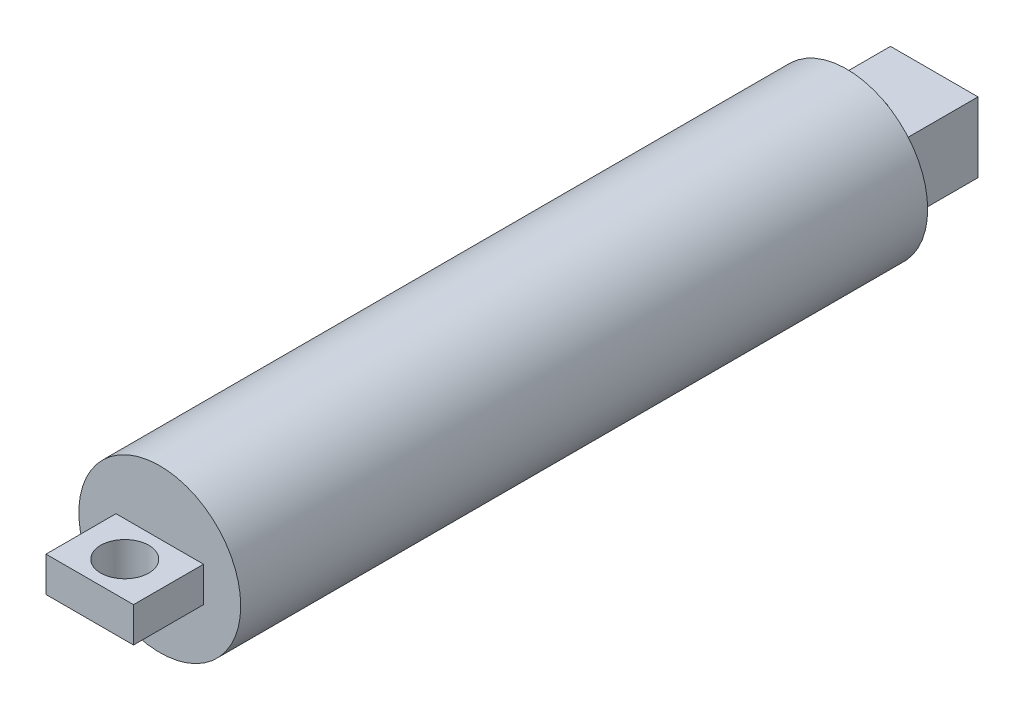
from build123d import *

# Parameters (mm, degrees)
SKETCH_1_R               = 9.25
EXTRUDE_1_DEPTH          = 78.5
SKETCH_2_W               = 10
SKETCH_2_H               = 8
EXTRUDE_2_DEPTH          = 10
SKETCH_3_W               = 10
SKETCH_3_H               = 4
EXTRUDE_3_DEPTH          = 8
CUT_EXTRUDE_1_DEPTH      = 88.996448792
CUT_EXTRUDE_1_DEPTH_BACK = 88.996448792
SKETCH_5_R               = 1.65
SKETCH_5_R_2             = 2.75


with BuildPart() as part:
    # 草图1 → 凸台-拉伸1 (new body)
    with BuildSketch(Plane.XY):
        Circle(SKETCH_1_R)
    extrude(amount=EXTRUDE_1_DEPTH)

    # 草图2 → 凸台-拉伸2 (add)
    with BuildSketch(Plane(origin=(0, 0, 0), x_dir=(-1, 0, 0), z_dir=(0, 0, -1))):
        Rectangle(SKETCH_2_W, SKETCH_2_H)
    extrude(amount=EXTRUDE_2_DEPTH)

    # 草图3 → 凸台-拉伸3 (add)
    with BuildSketch(Plane.XY.offset(78.5)):
        Rectangle(SKETCH_3_W, SKETCH_3_H)
    extrude(amount=EXTRUDE_3_DEPTH)

    # 草图5 → 切除-拉伸1 (cut, two sides: drawn at the far end of the back side and taken through both)
    with BuildSketch(Plane(origin=(0, 4, 0), x_dir=(1, 0, 0), z_dir=(0, 1, 0)).offset(-CUT_EXTRUDE_1_DEPTH_BACK)):
        with Locations(Location((0, 2.5, 0), (0, 0, 180))):
            Circle(SKETCH_5_R)
        with Locations(Location((0, -82.5, 0), (0, 0, 180))):
            Circle(SKETCH_5_R_2)
    extrude(amount=CUT_EXTRUDE_1_DEPTH + CUT_EXTRUDE_1_DEPTH_BACK, mode=Mode.SUBTRACT)


solid = part.part
